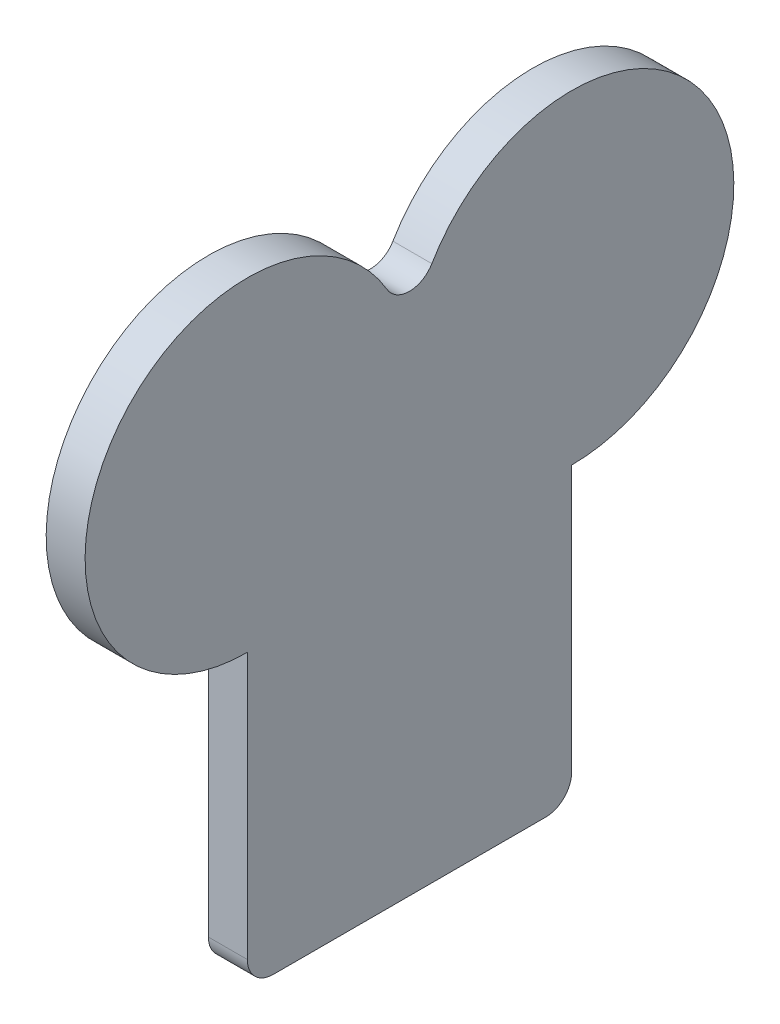
from build123d import *

# Parameters (mm, degrees)
BOSS_EXTRUDE1_DEPTH = 15
FILLET1_R           = 10
FILLET2_R           = 10


with BuildPart() as part:
    # Sketch1 → Boss-Extrude1 (new body)
    with BuildSketch(Plane(origin=(0, 0, 0), x_dir=(0, 0, -1), z_dir=(1, 0, 0))):
        with BuildLine():
            Line((-62.5, 25), (-62.5, -87.5))
            Line((-62.5, -87.5), (62.5, -87.5))
            Line((62.5, -87.5), (62.5, 25))
            ThreePointArc((62.5, 25), (106.694173824, 131.694173824), (0, 87.5))
            ThreePointArc((0, 87.5), (-106.694173824, 131.694173824), (-62.5, 25))
        make_face()
    extrude(amount=BOSS_EXTRUDE1_DEPTH)

    # Fillet1
    fillet1_edges = [part.edges().sort_by_distance(p)[0] for p in [
        (7.5, 87.5, 0),
    ]]
    fillet(fillet1_edges, radius=FILLET1_R)

    # Fillet2
    fillet2_edges = [part.edges().sort_by_distance(p)[0] for p in [
        (7.5, -87.5, -62.5),
        (7.5, -87.5, 62.5),
    ]]
    fillet(fillet2_edges, radius=FILLET2_R)


solid = part.part
